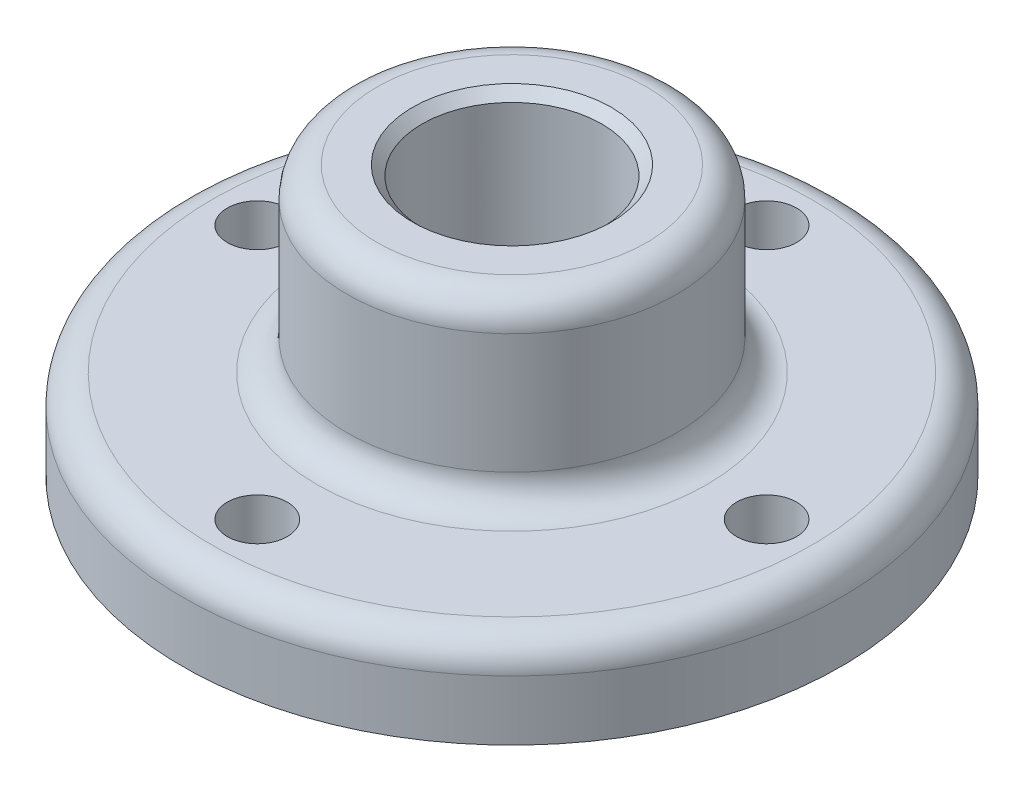
from build123d import *

# Parameters (mm, degrees)
SKETCH8_R          = 19.05
CUT_EXTRUDE2_DEPTH = 115.123474798
SKETCH9_R          = 6.35
CUT_EXTRUDE3_DEPTH = 106.875658203
CIRPATTERN1_COUNT  = 4
FILLET1_R          = 6.35
CHAMFER1_SIZE      = 2.032


with BuildPart() as part:
    # Sketch7 → Revolve1 (revolve)
    with BuildSketch(Plane.XY, mode=Mode.PRIVATE) as revolve1_sk:
        Polygon((34.925, 0), (69.85, 0), (69.85, -19.05), (0, -19.05), (0, 0), (0, 38.1), (34.925, 38.1), align=None)
    revolve(revolve1_sk.sketch.rotate(Axis((0, 38.1, 0), (0, -1, 0)), 270), axis=Axis((0, 38.1, 0), (0, -1, 0)))

    # Sketch8 → Cut-Extrude2 (cut, through all)
    with BuildSketch(Plane(origin=(0, 38.1, 0), x_dir=(1, 0, 0), z_dir=(0, 1, 0))):
        with Locations(Location((0, 0, 0), (0, 0, 270))):
            Circle(SKETCH8_R)
    extrude(amount=-CUT_EXTRUDE2_DEPTH, mode=Mode.SUBTRACT)

    # Sketch9 → Cut-Extrude3 (cut, through all)
    with BuildSketch(Plane(origin=(0, 0, 0), x_dir=(1, 0, 0), z_dir=(0, 1, 0))):
        with Locations(Location((0, 53.975, 0), (0, 0, 270))):
            Circle(SKETCH9_R)
    cut_extrude3 = extrude(amount=-CUT_EXTRUDE3_DEPTH, mode=Mode.SUBTRACT)

    # CirPattern1: Cut-Extrude3 ×4 about axis
    cirpattern1_axis = Axis((0, 0, 0), (0, 1, 0))
    for i in range(1, CIRPATTERN1_COUNT):
        add(cut_extrude3.rotate(cirpattern1_axis, i * 360 / CIRPATTERN1_COUNT), mode=Mode.SUBTRACT)

    # Fillet1
    fillet1_edges = [part.edges().sort_by_distance(p)[0] for p in [
        (0, 38.1, 34.925),
        (0, 0, 34.925),
        (0, 0, 69.85),
    ]]
    fillet(fillet1_edges, radius=FILLET1_R)

    # Chamfer1
    chamfer1_edges = [part.edges().sort_by_distance(p)[0] for p in [
        (0, 38.1, -19.05),
    ]]
    chamfer(chamfer1_edges, length=CHAMFER1_SIZE)


solid = part.part
